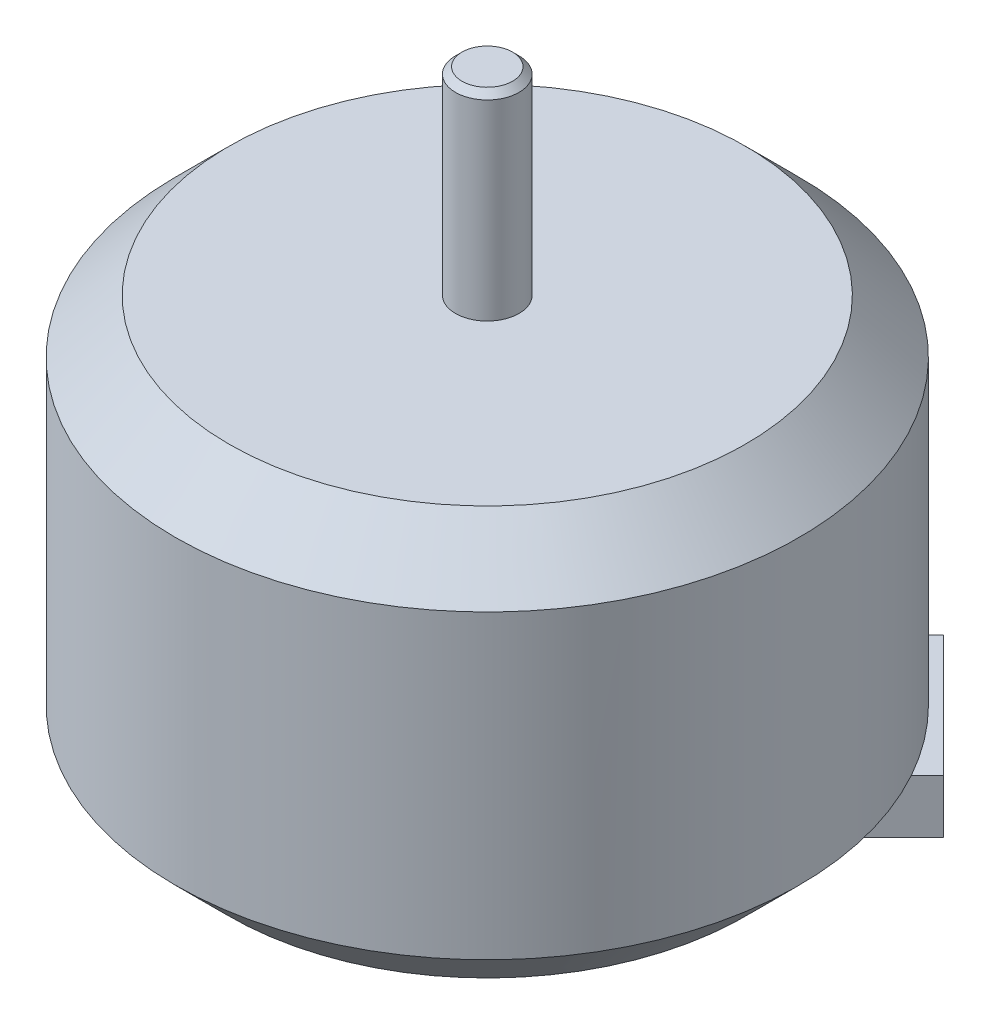
from build123d import *

# Parameters (mm, degrees)
SKIZZE1_R                  = 14.5
GRUNDKOERPER_DEPTH         = 19
GRUNDKOERPERFASE_SIZE      = 2.5
MONTAGEBOHRUNG_UNTEN_D     = 2.5
MONTAGEBOHRUNG_UNTEN_DEPTH = 3
MONTAGEBOHRUNG_UNTEN_TIP   = 0.751075774
SKIZZE6_W                  = 1.475
SKIZZE6_H                  = 9.2
AUFNAHME_FASE_SIZE         = 0.3
SKIZZE7_R                  = 3
WELLENUEBERSTAND_DEPTH     = 1
SKIZZE8_W                  = 2.5
SKIZZE8_H                  = 8
KABELANSCHLUSS_DEPTH       = 5


with BuildPart() as part:
    # Skizze1 → Grundkoerper (new body)
    with BuildSketch(Plane(origin=(0, 0, 0), x_dir=(1, 0, 0), z_dir=(0, 1, 0))):
        Circle(SKIZZE1_R)
    extrude(amount=GRUNDKOERPER_DEPTH)

    # Grundkoerperfase
    grundkoerperfase_edges = [part.edges().sort_by_distance(p)[0] for p in [
        (-14.5, 0, 0),
        (-14.5, 19, 0),
    ]]
    chamfer(grundkoerperfase_edges, length=GRUNDKOERPERFASE_SIZE)

    # Montagebohrung unten
    with Locations(Plane(origin=(0, 0, 0), x_dir=(-1, 0, 0), z_dir=(0, -1, 0))):
        with Locations((9.5, 0), (0, -8), (-9.5, 0), (0, 8)):
            Hole(MONTAGEBOHRUNG_UNTEN_D / 2, depth=MONTAGEBOHRUNG_UNTEN_DEPTH)
            with Locations((0, 0, -(MONTAGEBOHRUNG_UNTEN_DEPTH + MONTAGEBOHRUNG_UNTEN_TIP / 2))):  # 118° drill point
                Cone(0, MONTAGEBOHRUNG_UNTEN_D / 2, MONTAGEBOHRUNG_UNTEN_TIP, mode=Mode.SUBTRACT)

    # Skizze6 → Propelleraufnahme (revolve)
    with BuildSketch(Plane.XY):
        with Locations((0.7375, 23.6)):
            Rectangle(SKIZZE6_W, SKIZZE6_H)
    revolve(axis=Axis((0, -3.27786324, 0), (0, 1, 0)))

    # Aufnahme_Fase
    aufnahme_fase_edges = [part.edges().sort_by_distance(p)[0] for p in [
        (-1.475, 28.2, 0),
    ]]
    chamfer(aufnahme_fase_edges, length=AUFNAHME_FASE_SIZE)

    # Skizze7 → Wellenueberstand (add)
    with BuildSketch(Plane.XZ):
        Circle(SKIZZE7_R)
    extrude(amount=WELLENUEBERSTAND_DEPTH)

    # Skizze8 → Kabelanschluss (add)
    with BuildSketch(Plane(origin=(7.071067812, 0, -7.071067812), x_dir=(0, 1, 0), z_dir=(-0.7071067811865488, 0, 0.7071067811865464))):
        with Locations((1.25, 0)):
            Rectangle(SKIZZE8_W, SKIZZE8_H)
    extrude(amount=-KABELANSCHLUSS_DEPTH)


solid = part.part
